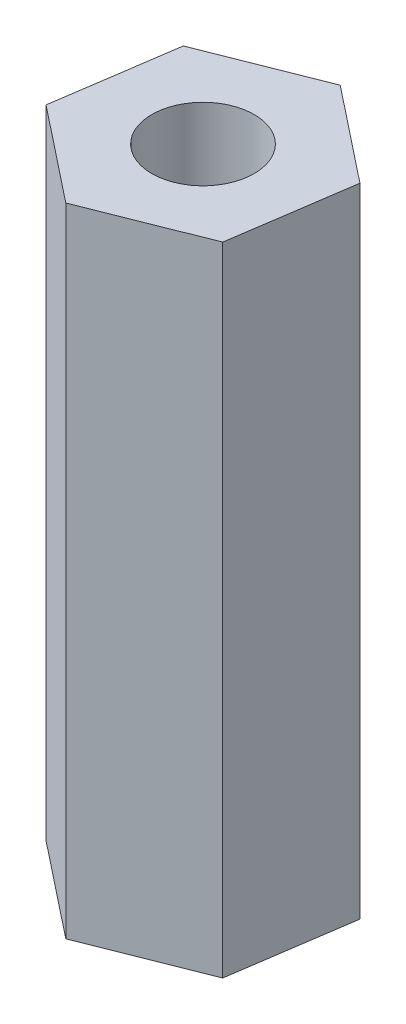
from build123d import *

# Parameters (mm, degrees)
SALIENTE_EXTRUIR1_DEPTH = 14
CROQUIS_CARA_R          = 1.125
CORTAR_EXTRUIR1_DEPTH   = 15.456788112


with BuildPart() as part:
    # Croquis base → Saliente-Extruir1 (new body)
    with BuildSketch(Plane(origin=(0, 0, 0), x_dir=(1, 0, 0), z_dir=(0, 1, 0))):
        Polygon((2.082277712, -1.648469855), (2.468755628, 0.979070469), (0.386477916, 2.627540324), (-2.082277712, 1.648469855), (-2.468755628, -0.979070469), (-0.386477916, -2.627540324), align=None)
    extrude(amount=SALIENTE_EXTRUIR1_DEPTH)

    # Croquis cara → Cortar-Extruir1 (cut, through all)
    with BuildSketch(Plane(origin=(0, 14, 0), x_dir=(1, 0, 0), z_dir=(0, 1, 0))):
        with Locations(Location((0, 0, 0), (0, 0, 270))):
            Circle(CROQUIS_CARA_R)
    extrude(amount=-CORTAR_EXTRUIR1_DEPTH, mode=Mode.SUBTRACT)


solid = part.part
